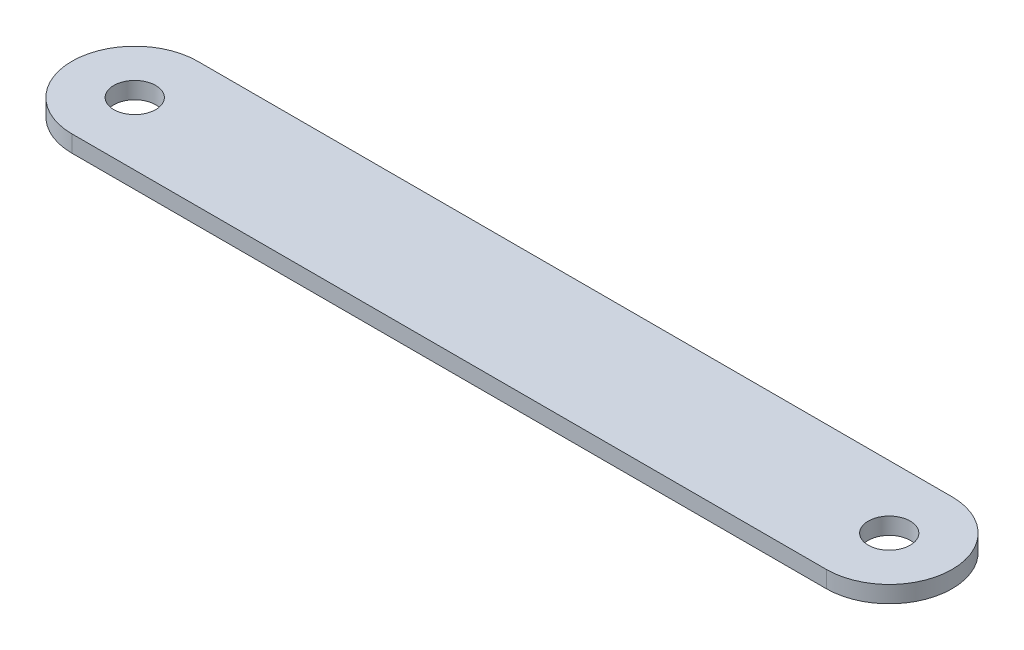
from build123d import *

# Parameters (mm, degrees)
EXTRUDE_1_DEPTH     = 4
SKETCH_2_R          = 5
CUT_EXTRUDE_1_DEPTH = 196.616972679


with BuildPart() as part:
    # 草图1 → 凸台-拉伸1 (new body)
    with BuildSketch(Plane(origin=(0, 0, 0), x_dir=(1, 0, 0), z_dir=(0, 1, 0))):
        with BuildLine():
            Line((0, -15), (-180, -15))
            ThreePointArc((-180, -15), (-195, 0), (-180, 15))
            Line((-180, 15), (0, 15))
            ThreePointArc((0, 15), (15, 0), (0, -15))
        make_face()
    extrude(amount=EXTRUDE_1_DEPTH)

    # 草图2 → 切除-拉伸1 (cut, through all)
    with BuildSketch(Plane(origin=(0, 4, 0), x_dir=(1, 0, 0), z_dir=(0, 1, 0))):
        with Locations(Location((0, 0, 0), (0, 0, 270))):
            Circle(SKETCH_2_R)
        with Locations(Location((-180, 0, 0), (0, 0, 270))):
            Circle(SKETCH_2_R)
    extrude(amount=-CUT_EXTRUDE_1_DEPTH, mode=Mode.SUBTRACT)


solid = part.part
